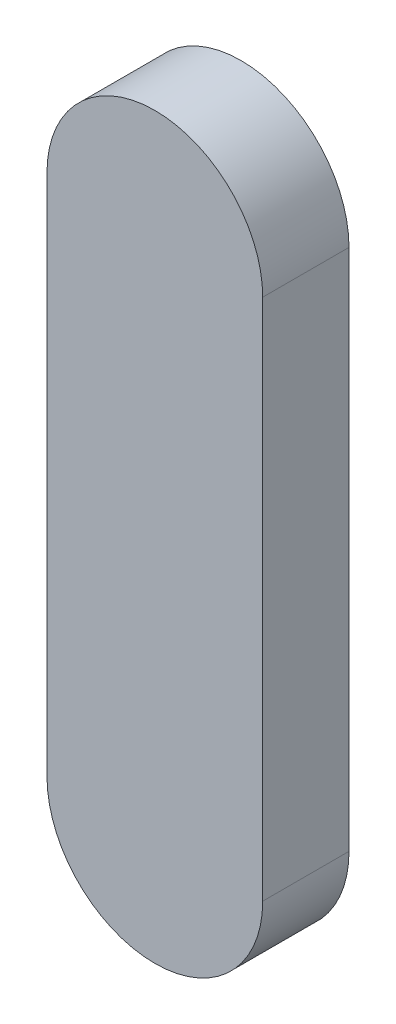
from build123d import *

# Parameters (mm, degrees)
BOSS_EXTRUDE1_DEPTH = 2.54


with BuildPart() as part:
    # Sketch1 → Boss-Extrude1 (new body)
    with BuildSketch(Plane.XY):
        with BuildLine():
            Line((104.705582605, -39.448248577), (104.705582605, -24.051751423))
            ThreePointArc((104.705582605, -24.051751423), (101.530582605, -20.876751423), (98.355582605, -24.051751423))
            Line((98.355582605, -24.051751423), (98.355582605, -39.448248577))
            ThreePointArc((98.355582605, -39.448248577), (101.530582605, -42.623248577), (104.705582605, -39.448248577))
        make_face()
    extrude(amount=BOSS_EXTRUDE1_DEPTH)


solid = part.part
